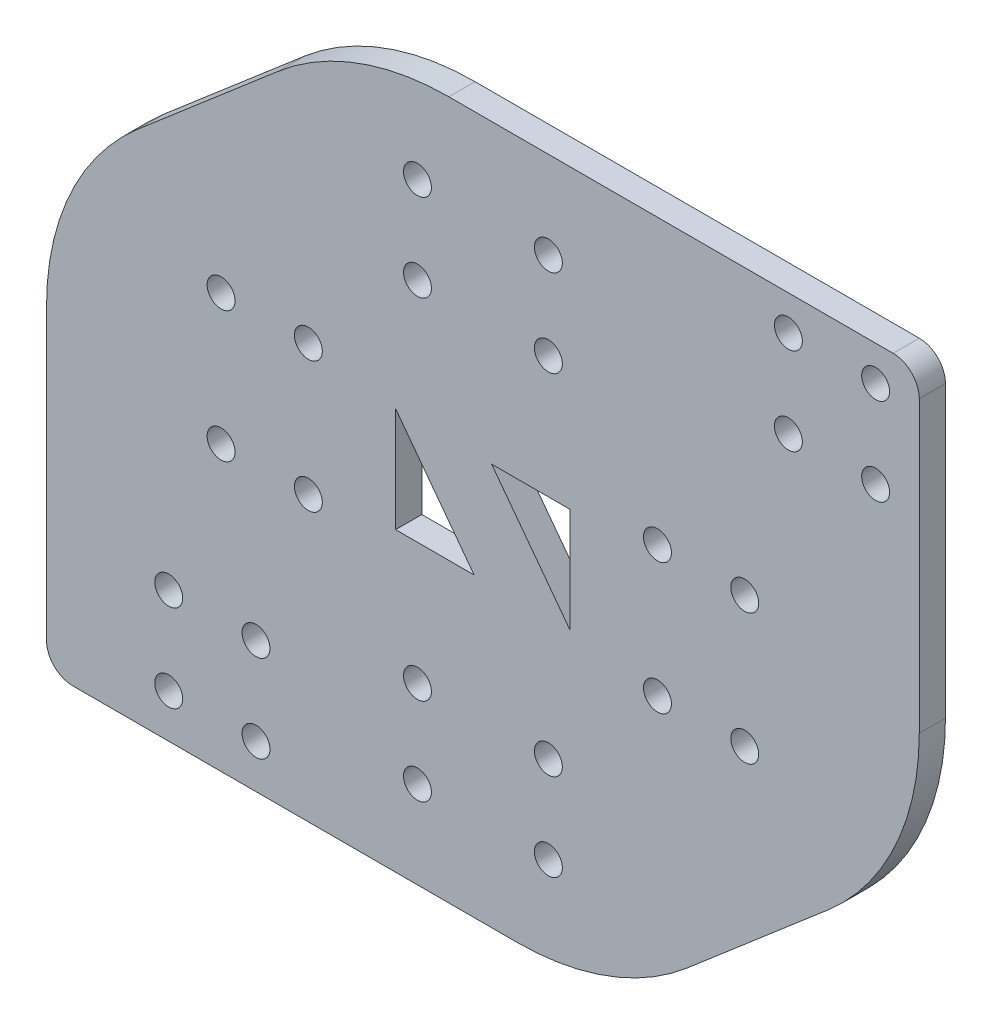
from build123d import *

# Parameters (mm, degrees)
SKETCH_1_W          = 100
SKETCH_1_H          = 80
EXTRUDE_1_DEPTH     = 3
SKETCH_2_R          = 1.6
CUT_EXTRUDE_1_DEPTH = 129.097619025
FILLET_1_R          = 30
FILLET_2_R          = 30
FILLET_3_R          = 3


with BuildPart() as part:
    # 草图1 → 凸台-拉伸1 (new body)
    with BuildSketch(Plane.XY):
        with Locations((50, -40)):
            Rectangle(SKETCH_1_W, SKETCH_1_H)
    extrude(amount=EXTRUDE_1_DEPTH)

    # 草图2 → 切除-拉伸1 (cut, through all)
    with BuildSketch(Plane.XY.offset(3)):
        with Locations((42.5, -10)):
            Circle(SKETCH_2_R)
        with Locations(Location((57.5, -10, 0), (0, 0, 180))):
            Circle(SKETCH_2_R)
        with Locations((57.5, -20)):
            Circle(SKETCH_2_R)
        with Locations(Location((42.5, -20, 0), (0, 0, 180))):
            Circle(SKETCH_2_R)
        with Locations((42.5, -60)):
            Circle(SKETCH_2_R)
        with Locations(Location((57.5, -60, 0), (0, 0, 180))):
            Circle(SKETCH_2_R)
        with Locations((57.5, -70)):
            Circle(SKETCH_2_R)
        with Locations(Location((42.5, -70, 0), (0, 0, 180))):
            Circle(SKETCH_2_R)
        with Locations((20, -32.5)):
            Circle(SKETCH_2_R)
        with Locations(Location((30, -32.5, 0), (0, 0, 180))):
            Circle(SKETCH_2_R)
        with Locations((30, -47.5)):
            Circle(SKETCH_2_R)
        with Locations(Location((20, -47.5, 0), (0, 0, 180))):
            Circle(SKETCH_2_R)
        with Locations((80, -47.5)):
            Circle(SKETCH_2_R)
        with Locations(Location((70, -47.5, 0), (0, 0, 180))):
            Circle(SKETCH_2_R)
        with Locations((70, -32.5)):
            Circle(SKETCH_2_R)
        with Locations(Location((80, -32.5, 0), (0, 0, 180))):
            Circle(SKETCH_2_R)
        with Locations((14, -65)):
            Circle(SKETCH_2_R)
        with Locations(Location((24, -65, 0), (0, 0, 180))):
            Circle(SKETCH_2_R)
        with Locations((24, -75)):
            Circle(SKETCH_2_R)
        with Locations(Location((14, -75, 0), (0, 0, 180))):
            Circle(SKETCH_2_R)
        with Locations((95, -4)):
            Circle(SKETCH_2_R)
        with Locations(Location((85, -4, 0), (0, 0, 180))):
            Circle(SKETCH_2_R)
        with Locations(Location((95, -14, 0), (0, 0, 180))):
            Circle(SKETCH_2_R)
        with Locations((85, -14)):
            Circle(SKETCH_2_R)
        Polygon((35, 0), (0, -30), (0, 0), align=None)
        Polygon((100, -80), (100, -50), (65, -80), align=None)
        Polygon((40, -34), (40, -46), (49, -46), align=None)
        Polygon((51, -34), (60, -46), (60, -34), align=None)
    extrude(amount=-CUT_EXTRUDE_1_DEPTH, mode=Mode.SUBTRACT)

    # 圆角1
    fillet_1_edges = [part.edges().sort_by_distance(p)[0] for p in [
        (0, -30, 1.5),
        (100, -50, 1.5),
    ]]
    fillet(fillet_1_edges, radius=FILLET_1_R)

    # 圆角2
    fillet_2_edges = [part.edges().sort_by_distance(p)[0] for p in [
        (35, 0, 1.5),
        (65, -80, 1.5),
    ]]
    fillet(fillet_2_edges, radius=FILLET_2_R)

    # 圆角3
    fillet_3_edges = [part.edges().sort_by_distance(p)[0] for p in [
        (100, 0, 1.5),
        (0, -80, 1.5),
    ]]
    fillet(fillet_3_edges, radius=FILLET_3_R)


solid = part.part
